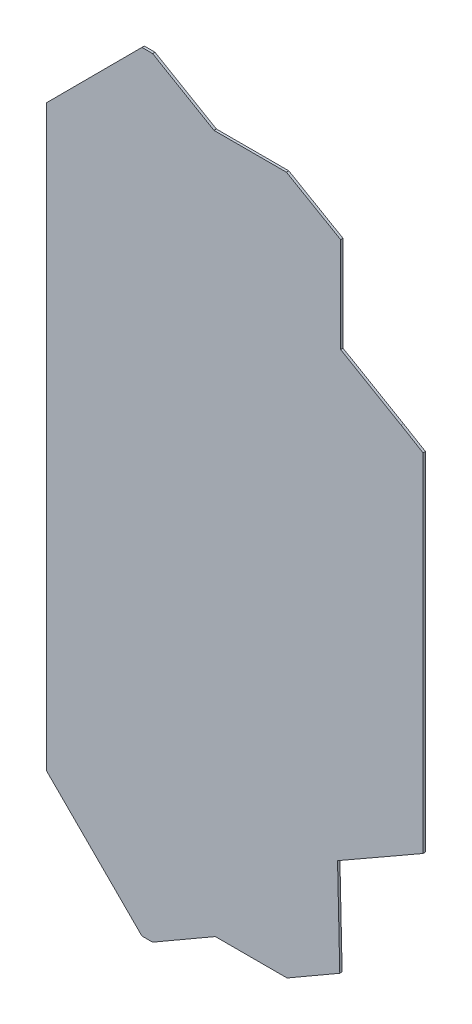
from build123d import *

# Parameters (mm, degrees)
BOSS_EXTRUDE1_DEPTH = 2


with BuildPart() as part:
    # Sketch1 → Boss-Extrude1 (new body)
    with BuildSketch(Plane.XY):
        Polygon((361.630033999, -374.454471748), (380.137424167, -385.482102825), (380.137424167, -677.655091144), (308.129986991, -718.87407691), (310.006107747, -800.065781327), (265.623696466, -825.689978427), (205.209876552, -825.689978427), (152.401012428, -856.179190345), (143.408151905, -856.179190345), (63.136987148, -775.908025588), (63.136987148, -288.672979409), (143.408151905, -208.178753325), (152.401012428, -208.178753325), (204.095362303, -238.355797614), (265.083006274, -238.355797614), (310.72855649, -264.709268319), (310.72855649, -344.878540631), align=None)
    extrude(amount=BOSS_EXTRUDE1_DEPTH)


solid = part.part
